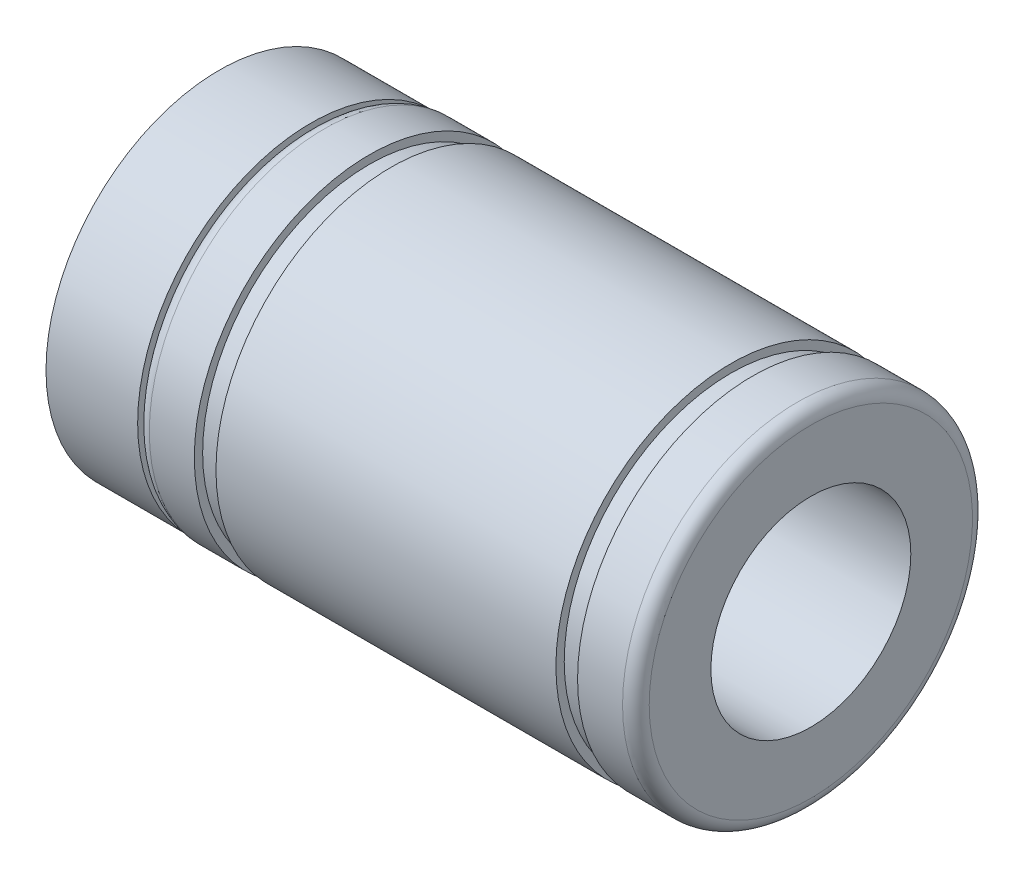
from build123d import *

# Parameters (mm, degrees)
SKETCH2_W = 5.5
SKETCH2_H = 4.4


with BuildPart() as part:
    # Sketch1 → Revolve1 (revolve)
    with BuildSketch(Plane.XY, mode=Mode.PRIVATE) as revolve1_sk:
        with BuildLine():
            Line((-15, 9.7), (-15, 6))
            Line((-15, 6), (15, 6))
            Line((15, 6), (15, 9.7))
            ThreePointArc((15, 9.7), (14.765685425, 10.265685425), (14.2, 10.5))
            Line((14.2, 10.5), (11.5, 10.5))
            Line((11.5, 10.5), (11.5, 10))
            Line((11.5, 10), (10.2, 10))
            Line((10.2, 10), (10.2, 10.5))
            Line((10.2, 10.5), (-10.2, 10.5))
            Line((-10.2, 10.5), (-10.2, 10))
            Line((-10.2, 10), (-11.5, 10))
            Line((-11.5, 10), (-11.5, 10.5))
            Line((-11.5, 10.5), (-14.2, 10.5))
            ThreePointArc((-14.2, 10.5), (-14.765685425, 10.265685425), (-15, 9.7))
        make_face()
    revolve(revolve1_sk.sketch.rotate(Axis((15, 0, 0), (-1, 0, 0)), 270), axis=Axis((15, 0, 0), (-1, 0, 0)))

    # Sketch2 → Revolve2 (revolve)
    with BuildSketch(Plane.XY, mode=Mode.PRIVATE) as revolve2_sk:
        with Locations((-17.75, 8.2)):
            Rectangle(SKETCH2_W, SKETCH2_H)
    revolve(revolve2_sk.sketch.rotate(Axis((-15, 0, 0), (-1, 0, 0)), 270), axis=Axis((-15, 0, 0), (-1, 0, 0)))


solid = part.part
